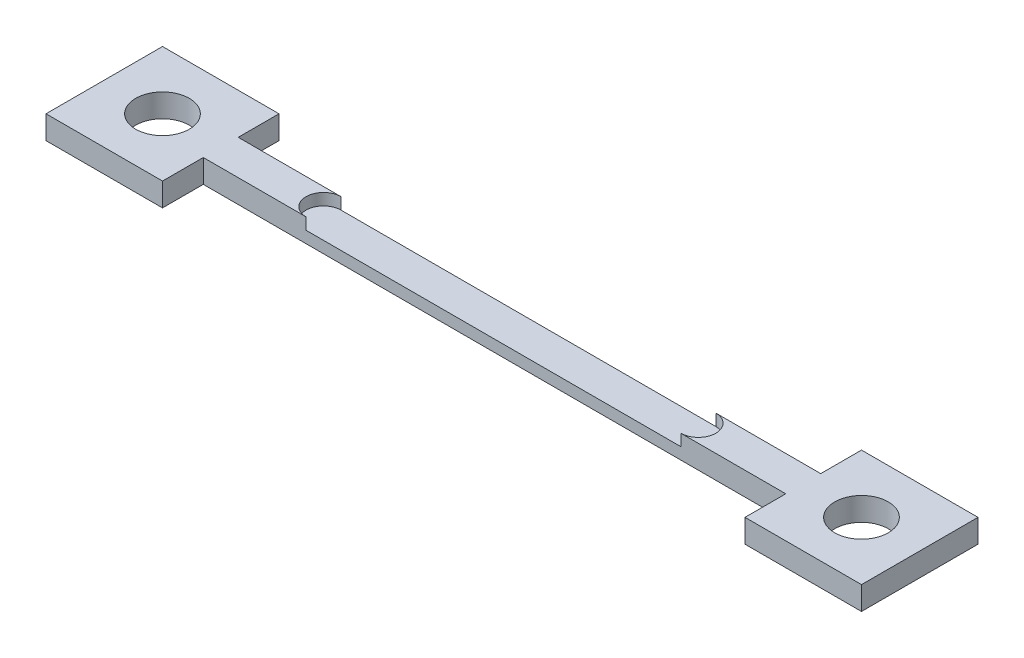
from build123d import *

# Parameters (mm, degrees)
BOSS_EXTRUDE1_DEPTH          = 0.635
F_97_0_0059_DIAMETER_HOLE1_D = 2.921
CUT_EXTRUDE8_DEPTH           = 0.635


with BuildPart() as part:
    # Sketch1 → Boss-Extrude1 (new, symmetric)
    with BuildSketch(Plane(origin=(0, 0, 0), x_dir=(1, 0, 0), z_dir=(0, 1, 0))):
        Polygon((-41.424046485, -10.283259465), (-41.424046485, -12.505759465), (-47.774046485, -12.505759465), (-47.774046485, -6.155759465), (-41.424046485, -6.155759465), (-41.424046485, -8.378259465), (-9.674046485, -8.378259465), (-9.674046485, -6.155759465), (-3.324046485, -6.155759465), (-3.324046485, -12.505759465), (-9.674046485, -12.505759465), (-9.674046485, -10.283259465), align=None)
    extrude(amount=BOSS_EXTRUDE1_DEPTH, both=True)

    # #97 (0.0059) Diameter Hole1 (through all)
    with Locations(Plane(origin=(0, 0.635, 0), x_dir=(-1, 0, 0), z_dir=(0, 1, 0))):
        with Locations((44.599046485, 9.330759465)):
            f_97_0_0059_diameter_hole1 = Hole(F_97_0_0059_DIAMETER_HOLE1_D / 2)

    # Mirror1: #97 (0.0059) Diameter Hole1 across plane
    add(f_97_0_0059_diameter_hole1.mirror(Plane(origin=(-25.549046485, 0, 0), x_dir=(0, 0, 1), z_dir=(1, 0, 0))), mode=Mode.SUBTRACT)

    # Sketch5 → Cut-Extrude8 (cut)
    with BuildSketch(Plane(origin=(0, 0.635, 0), x_dir=(1, 0, 0), z_dir=(0, 1, 0))):
        with BuildLine():
            Line((-15.39166679, -8.378259465), (-35.821920417, -8.378259465))
            ThreePointArc((-35.821920417, -8.378259465), (-36.774420417, -9.330759465), (-35.821920417, -10.283259465))
            Line((-35.821920417, -10.283259465), (-15.39166679, -10.283259465))
            ThreePointArc((-15.39166679, -10.283259465), (-14.43916679, -9.330759465), (-15.39166679, -8.378259465))
        make_face()
    extrude(amount=-CUT_EXTRUDE8_DEPTH, mode=Mode.SUBTRACT)


solid = part.part
